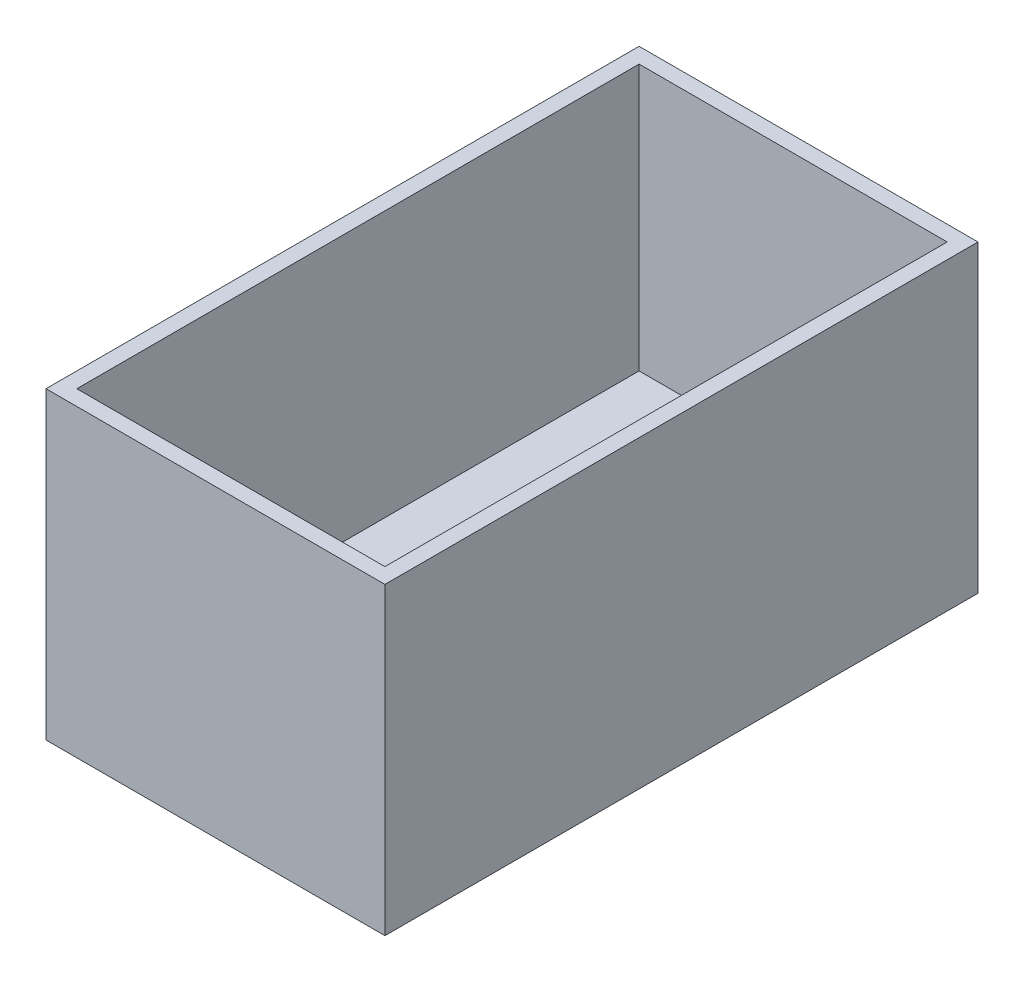
from build123d import *

# Parameters (mm, degrees)
EXTRUDE_1_DEPTH     = 73
SKETCH_2_W          = 44
SKETCH_2_H          = 39.5
EXTRUDE_2_DEPTH     = 2
SKETCH_3_W          = 44
SKETCH_3_H          = 39.5
EXTRUDE_3_DEPTH     = 2
SKETCH_4_R          = 2.75
CUT_EXTRUDE_1_DEPTH = 10
SKETCH_5_R          = 5.75
SKETCH_5_R_2        = 2.75
CUT_EXTRUDE_2_DEPTH = 3


with BuildPart() as part:
    # 草图1 → 凸台-拉伸1 (new body)
    with BuildSketch(Plane.XY):
        Polygon((-17.828125, 6.526041667), (-17.828125, -32.973958333), (26.171875, -32.973958333), (26.171875, 6.526041667), (24.171875, 6.526041667), (24.171875, -27.973958333), (-15.828125, -27.973958333), (-15.828125, 6.526041667), align=None)
    extrude(amount=EXTRUDE_1_DEPTH)

    # 草图2 → 凸台-拉伸2 (add)
    with BuildSketch(Plane.XY.offset(73)):
        with Locations((4.171875, -13.223958333)):
            Rectangle(SKETCH_2_W, SKETCH_2_H)
    extrude(amount=EXTRUDE_2_DEPTH)

    # 草图3 → 凸台-拉伸3 (add)
    with BuildSketch(Plane(origin=(0, 0, 0), x_dir=(-1, 0, 0), z_dir=(0, 0, -1))):
        with Locations((-4.171875, -13.223958333)):
            Rectangle(SKETCH_3_W, SKETCH_3_H)
    extrude(amount=EXTRUDE_3_DEPTH)

    # 草图4 → 切除-拉伸1 (cut)
    with BuildSketch(Plane(origin=(0, -27.973958333, 0), x_dir=(1, 0, 0), z_dir=(0, 1, 0))):
        with Locations(Location((4.171875, -26.5, 0), (0, 0, 180))):
            Circle(SKETCH_4_R)
        with Locations(Location((4.171875, -46.5, 0), (0, 0, 180))):
            Circle(SKETCH_4_R)
        with Locations(Location((4.171875, -11.5, 0), (0, 0, 180))):
            Circle(SKETCH_4_R)
        with Locations(Location((4.171875, -61.5, 0), (0, 0, 180))):
            Circle(SKETCH_4_R)
    extrude(amount=-CUT_EXTRUDE_1_DEPTH, mode=Mode.SUBTRACT)

    # 草图5 → 切除-拉伸2 (cut)
    # profile 1 of 4: a face of its own
    with BuildSketch(Plane(origin=(0, -27.973958333, 0), x_dir=(1, 0, 0), z_dir=(0, 1, 0))):
        with Locations(Location((4.171875, -61.5, 0), (0, 0, 180))):
            Circle(SKETCH_5_R)
        with Locations(Location((4.171875, -61.5, 0), (0, 0, 180))):
            Circle(SKETCH_5_R_2, mode=Mode.SUBTRACT)
    # profile 2 of 4: a face of its own
    with BuildSketch(Plane(origin=(0, -27.973958333, 0), x_dir=(1, 0, 0), z_dir=(0, 1, 0))):
        with Locations(Location((4.171875, -46.5, 0), (0, 0, 180))):
            Circle(SKETCH_5_R)
        with Locations(Location((4.171875, -46.5, 0), (0, 0, 180))):
            Circle(SKETCH_5_R_2, mode=Mode.SUBTRACT)
    # profile 3 of 4: a face of its own
    with BuildSketch(Plane(origin=(0, -27.973958333, 0), x_dir=(1, 0, 0), z_dir=(0, 1, 0))):
        with Locations(Location((4.171875, -26.5, 0), (0, 0, 180))):
            Circle(SKETCH_5_R)
        with Locations(Location((4.171875, -26.5, 0), (0, 0, 180))):
            Circle(SKETCH_5_R_2, mode=Mode.SUBTRACT)
    # profile 4 of 4: a face of its own
    with BuildSketch(Plane(origin=(0, -27.973958333, 0), x_dir=(1, 0, 0), z_dir=(0, 1, 0))):
        with Locations(Location((4.171875, -11.5, 0), (0, 0, 180))):
            Circle(SKETCH_5_R)
        with Locations(Location((4.171875, -11.5, 0), (0, 0, 180))):
            Circle(SKETCH_5_R_2, mode=Mode.SUBTRACT)
    extrude(amount=-CUT_EXTRUDE_2_DEPTH, mode=Mode.SUBTRACT)


solid = part.part
